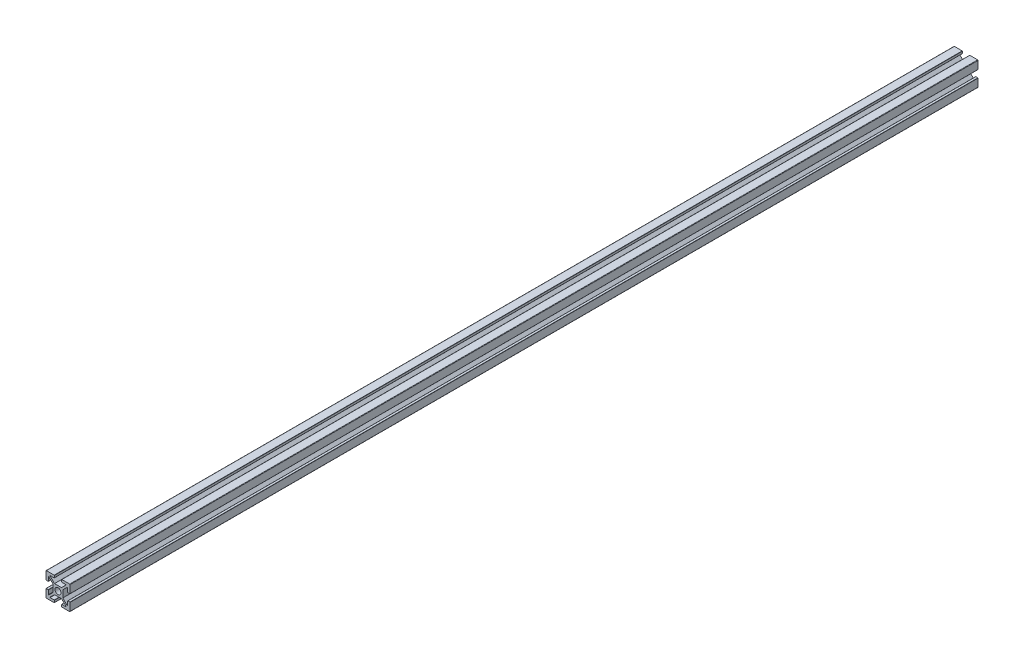
from build123d import *

# Parameters (mm, degrees)
SKETCH1_R           = 2.5
BOSS_EXTRUDE1_DEPTH = 760


with BuildPart() as part:
    # Sketch1 → Boss-Extrude1 (new body)
    with BuildSketch(Plane.XY):
        with BuildLine():
            Line((-31.376404226, -0.06181021), (-29.676404226, -0.06181021))
            ThreePointArc((-29.676404226, -0.06181021), (-29.570338208, -0.017876227), (-29.526404226, 0.08818979))
            Line((-29.526404226, 0.08818979), (-29.526404226, 3.524374304))
            ThreePointArc((-29.526404226, 3.524374304), (-29.43420518, 3.662790523), (-29.27095023, 3.631048831))
            Line((-29.27095023, 3.631048831), (-25.480107929, -0.116419988))
            Line((-25.480107929, -0.116419988), (-25.480107929, -6.007200432))
            Line((-25.480107929, -6.007200432), (-29.27095023, -9.754669251))
            ThreePointArc((-29.27095023, -9.754669251), (-29.43420518, -9.786410942), (-29.526404226, -9.647994723))
            Line((-29.526404226, -9.647994723), (-29.526404226, -6.21181021))
            ThreePointArc((-29.526404226, -6.21181021), (-29.570338208, -6.105744193), (-29.676404226, -6.06181021))
            Line((-29.676404226, -6.06181021), (-31.376404226, -6.06181021))
            ThreePointArc((-31.376404226, -6.06181021), (-31.482470243, -6.105744193), (-31.526404226, -6.21181021))
            Line((-31.526404226, -6.21181021), (-31.526404226, -12.71181021))
            ThreePointArc((-31.526404226, -12.71181021), (-31.423891599, -12.959297583), (-31.176404226, -13.06181021))
            Line((-31.176404226, -13.06181021), (-24.676404226, -13.06181021))
            ThreePointArc((-24.676404226, -13.06181021), (-24.570338208, -13.017876227), (-24.526404226, -12.91181021))
            Line((-24.526404226, -12.91181021), (-24.526404226, -11.21181021))
            ThreePointArc((-24.526404226, -11.21181021), (-24.570338208, -11.105744193), (-24.676404226, -11.06181021))
            Line((-24.676404226, -11.06181021), (-28.094489023, -11.06181021))
            ThreePointArc((-28.094489023, -11.06181021), (-28.233235517, -10.96881381), (-28.199943018, -10.805135682))
            Line((-28.199943018, -10.805135682), (-24.41329202, -7.06181021))
            Line((-24.41329202, -7.06181021), (-18.546923839, -7.06181021))
            Line((-18.546923839, -7.06181021), (-14.760272841, -10.805135682))
            ThreePointArc((-14.760272841, -10.805135682), (-14.726980342, -10.96881381), (-14.865726836, -11.06181021))
            Line((-14.865726836, -11.06181021), (-18.283811633, -11.06181021))
            ThreePointArc((-18.283811633, -11.06181021), (-18.38987765, -11.105744193), (-18.433811633, -11.21181021))
            Line((-18.433811633, -11.21181021), (-18.433811633, -12.91181021))
            ThreePointArc((-18.433811633, -12.91181021), (-18.38987765, -13.017876227), (-18.283811633, -13.06181021))
            Line((-18.283811633, -13.06181021), (-11.783811633, -13.06181021))
            ThreePointArc((-11.783811633, -13.06181021), (-11.53632426, -12.959297583), (-11.433811633, -12.71181021))
            Line((-11.433811633, -12.71181021), (-11.433811633, -6.21181021))
            ThreePointArc((-11.433811633, -6.21181021), (-11.477745616, -6.105744193), (-11.583811633, -6.06181021))
            Line((-11.583811633, -6.06181021), (-13.283811633, -6.06181021))
            ThreePointArc((-13.283811633, -6.06181021), (-13.38987765, -6.105744193), (-13.433811633, -6.21181021))
            Line((-13.433811633, -6.21181021), (-13.433811633, -9.647994723))
            ThreePointArc((-13.433811633, -9.647994723), (-13.526010678, -9.786410942), (-13.689265628, -9.754669251))
            Line((-13.689265628, -9.754669251), (-17.480107929, -6.007200432))
            Line((-17.480107929, -6.007200432), (-17.480107929, -0.116419988))
            Line((-17.480107929, -0.116419988), (-13.689265628, 3.631048831))
            ThreePointArc((-13.689265628, 3.631048831), (-13.526010678, 3.662790523), (-13.433811633, 3.524374304))
            Line((-13.433811633, 3.524374304), (-13.433811633, 0.08818979))
            ThreePointArc((-13.433811633, 0.08818979), (-13.38987765, -0.017876227), (-13.283811633, -0.06181021))
            Line((-13.283811633, -0.06181021), (-11.583811633, -0.06181021))
            ThreePointArc((-11.583811633, -0.06181021), (-11.477745616, -0.017876227), (-11.433811633, 0.08818979))
            Line((-11.433811633, 0.08818979), (-11.433811633, 6.58818979))
            ThreePointArc((-11.433811633, 6.58818979), (-11.53632426, 6.835677164), (-11.783811633, 6.93818979))
            Line((-11.783811633, 6.93818979), (-18.283811633, 6.93818979))
            ThreePointArc((-18.283811633, 6.93818979), (-18.38987765, 6.894255807), (-18.433811633, 6.78818979))
            Line((-18.433811633, 6.78818979), (-18.433811633, 5.08818979))
            ThreePointArc((-18.433811633, 5.08818979), (-18.38987765, 4.982123773), (-18.283811633, 4.93818979))
            Line((-18.283811633, 4.93818979), (-14.865726836, 4.93818979))
            ThreePointArc((-14.865726836, 4.93818979), (-14.726980342, 4.84519339), (-14.760272841, 4.681515262))
            Line((-14.760272841, 4.681515262), (-18.546923839, 0.93818979))
            Line((-18.546923839, 0.93818979), (-24.41329202, 0.93818979))
            Line((-24.41329202, 0.93818979), (-28.199943018, 4.681515262))
            ThreePointArc((-28.199943018, 4.681515262), (-28.233235517, 4.84519339), (-28.094489023, 4.93818979))
            Line((-28.094489023, 4.93818979), (-24.676404226, 4.93818979))
            ThreePointArc((-24.676404226, 4.93818979), (-24.570338208, 4.982123773), (-24.526404226, 5.08818979))
            Line((-24.526404226, 5.08818979), (-24.526404226, 6.78818979))
            ThreePointArc((-24.526404226, 6.78818979), (-24.570338208, 6.894255807), (-24.676404226, 6.93818979))
            Line((-24.676404226, 6.93818979), (-31.176404226, 6.93818979))
            ThreePointArc((-31.176404226, 6.93818979), (-31.423891599, 6.835677164), (-31.526404226, 6.58818979))
            Line((-31.526404226, 6.58818979), (-31.526404226, 0.08818979))
            ThreePointArc((-31.526404226, 0.08818979), (-31.482470243, -0.017876227), (-31.376404226, -0.06181021))
        make_face()
        with Locations((-21.480107929, -3.06181021)):
            Circle(SKETCH1_R, mode=Mode.SUBTRACT)
    extrude(amount=BOSS_EXTRUDE1_DEPTH)


solid = part.part
